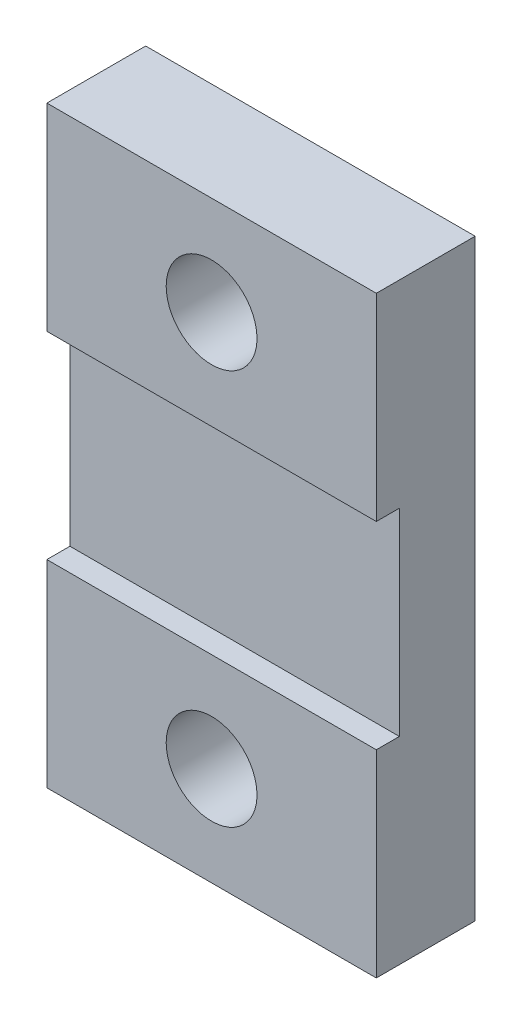
from build123d import *

# Parameters (mm, degrees)
SKETCH1_W           = 12.7
SKETCH1_H           = 22.86
SKETCH1_R           = 1.75
BOSS_EXTRUDE1_DEPTH = 3.81
SKETCH2_W           = 12.7
SKETCH2_H           = 7.62
CUT_EXTRUDE1_DEPTH  = 0.889


with BuildPart() as part:
    # Sketch1 → Boss-Extrude1 (new body)
    with BuildSketch(Plane.XY):
        Rectangle(SKETCH1_W, SKETCH1_H)
        with Locations(Location((0, 7.62, 0), (0, 0, 180))):
            Circle(SKETCH1_R, mode=Mode.SUBTRACT)
        with Locations(Location((0, -7.62, 0), (0, 0, 180))):
            Circle(SKETCH1_R, mode=Mode.SUBTRACT)
    extrude(amount=BOSS_EXTRUDE1_DEPTH)

    # Sketch2 → Cut-Extrude1 (cut)
    with BuildSketch(Plane.XY.offset(3.81)):
        Rectangle(SKETCH2_W, SKETCH2_H)
    extrude(amount=-CUT_EXTRUDE1_DEPTH, mode=Mode.SUBTRACT)


solid = part.part
